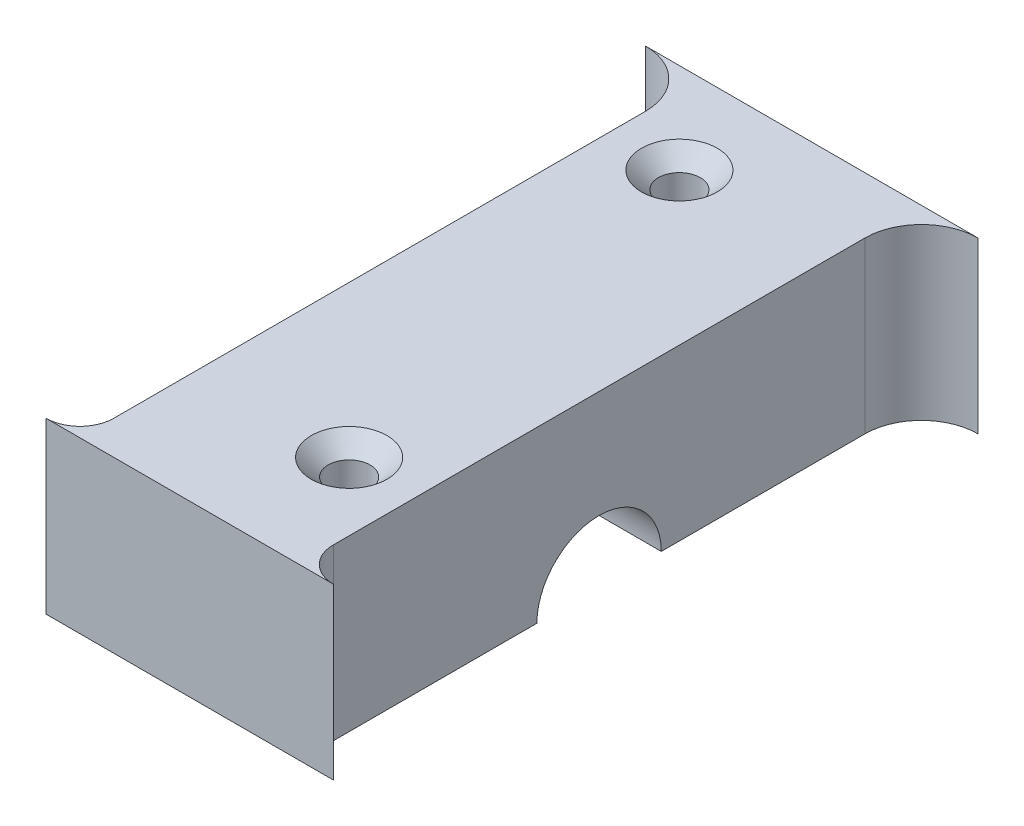
from build123d import *

# Parameters (mm, degrees)
RESSALTO_EXTRUS_O1_DEPTH   = 15
CORTE_EXTRUS_O1_DEPTH      = 59.873508474
CORTE_EXTRUS_O1_DEPTH_BACK = 59.873508474
ESBO_O3_R                  = 5.5
CORTE_EXTRUS_O2_DEPTH      = 2
CORTE_EXTRUS_O2_DEPTH_BACK = 2
ESBO_O4_R                  = 11.5
ESBO_O6_R                  = 1.85
CORTE_EXTRUS_O4_DEPTH      = 64.251561246
CHANFRO1_SIZE              = 1.5


with BuildPart() as part:
    # Esboço1 → Ressalto-extrusão1 (new body)
    with BuildSketch(Plane(origin=(0, 0, 0), x_dir=(1, 0, 0), z_dir=(0, 1, 0))):
        with BuildLine():
            Line((3, 50), (3, 3))
            ThreePointArc((3, 3), (2.121320344, 0.878679656), (0, 0))
            Line((0, 0), (25.4, 0))
            ThreePointArc((25.4, 0), (23.278679656, 0.878679656), (22.4, 3))
            Line((22.4, 3), (22.4, 50))
            ThreePointArc((22.4, 50), (23.864466094, 53.535533906), (27.4, 55))
            Line((27.4, 55), (-2, 55))
            ThreePointArc((-2, 55), (1.535533906, 53.535533906), (3, 50))
        make_face()
    extrude(amount=RESSALTO_EXTRUS_O1_DEPTH)

    # Esboço3 → Corte-extrusão1 (cut, two sides: drawn at the far end of the back side and taken through both)
    with BuildSketch(Plane(origin=(12.7, 0, 0), x_dir=(0, 0, -1), z_dir=(1, 0, 0)).offset(-CORTE_EXTRUS_O1_DEPTH_BACK)):
        with Locations((26.5, 0)):
            Circle(ESBO_O3_R)
    extrude(amount=CORTE_EXTRUS_O1_DEPTH + CORTE_EXTRUS_O1_DEPTH_BACK, mode=Mode.SUBTRACT)

    # Esboço4 → Corte-extrusão2 (cut, two sides: drawn at the far end of the back side and taken through both)
    with BuildSketch(Plane(origin=(12.7, 0, 0), x_dir=(0, 0, -1), z_dir=(1, 0, 0)).offset(-CORTE_EXTRUS_O2_DEPTH_BACK)):
        with Locations((26.5, 0)):
            Circle(ESBO_O4_R)
    extrude(amount=CORTE_EXTRUS_O2_DEPTH + CORTE_EXTRUS_O2_DEPTH_BACK, mode=Mode.SUBTRACT)

    # Esboço6 → Corte-extrusão4 (cut, through all)
    with BuildSketch(Plane.XZ):
        with Locations(Location((16.4, -10.4, 0), (0, 0, 270))):
            Circle(ESBO_O6_R)
        with Locations(Location((9, -47, 0), (0, 0, 270))):
            Circle(ESBO_O6_R)
    extrude(amount=-CORTE_EXTRUS_O4_DEPTH, mode=Mode.SUBTRACT)

    # Chanfro1
    chanfro1_edges = [part.edges().sort_by_distance(p)[0] for p in [
        (16.4, 15, -8.55),
        (9, 15, -45.15),
    ]]
    chamfer(chanfro1_edges, length=CHANFRO1_SIZE)


solid = part.part
